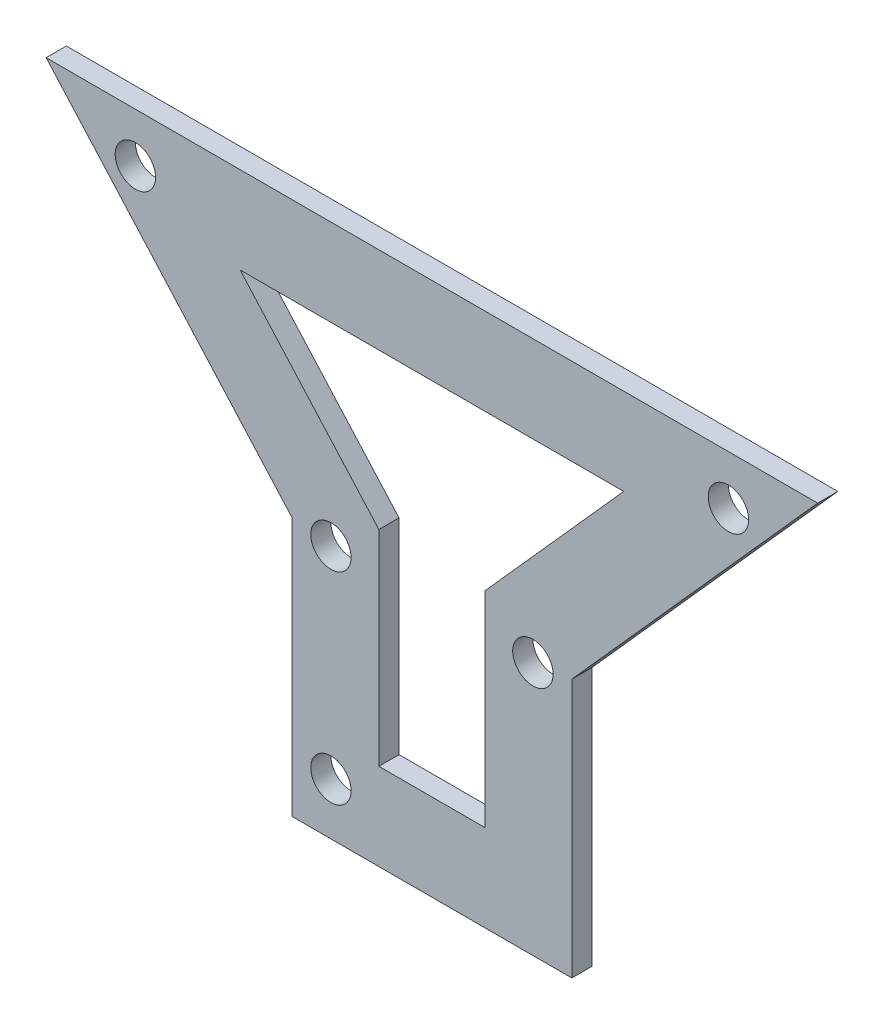
from build123d import *

# Parameters (mm, degrees)
EXTRUDE_2_DEPTH     = 10
SKETCH_6_R          = 10
CUT_EXTRUDE_2_DEPTH = 10


with BuildPart() as part:
    # Эскиз5 → Бобышка-Вытянуть2 (new body)
    with BuildSketch(Plane.XY):
        Polygon((69.270264014, 2.532805315), (69.270264014, -125.60178411), (-69.270264014, -125.60178411), (-69.270264014, 2.532805315), (-190.995381487, 138.884340659), (190.995381487, 138.884340659), align=None)
        Polygon((-26.270264014, -82.60178411), (26.270264014, -82.60178411), (26.270264014, 18.934099876), (94.96605886, 95.884340659), (-94.96605886, 95.884340659), (-26.270264014, 18.934099876), align=None, mode=Mode.SUBTRACT)
    extrude(amount=EXTRUDE_2_DEPTH)

    # Эскиз6 → Вырез-Вытянуть2 (cut)
    with BuildSketch(Plane.XY.offset(10)):
        with Locations((-146.807623039, 114.578724559)):
            Circle(SKETCH_6_R)
        with Locations((146.807623039, 114.578724559)):
            Circle(SKETCH_6_R)
        with Locations((-50, 0)):
            Circle(SKETCH_6_R)
        with Locations((-50, -100)):
            Circle(SKETCH_6_R)
        with Locations((50, 0)):
            Circle(SKETCH_6_R)
    extrude(amount=-CUT_EXTRUDE_2_DEPTH, mode=Mode.SUBTRACT)


solid = part.part
